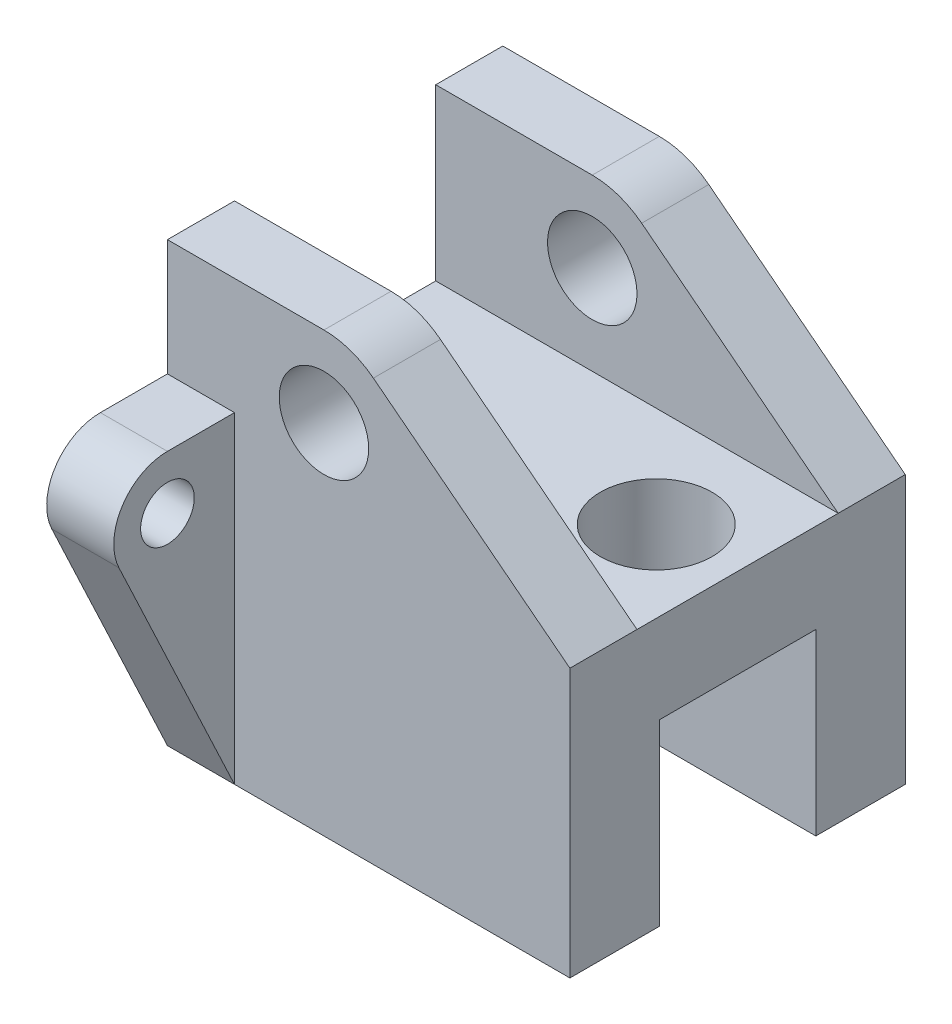
from build123d import *

# Parameters (mm, degrees)
BOSS_EXTRUDE1_DEPTH = 90
SKETCH2_R           = 10
BOSS_EXTRUDE2_DEPTH = 15
BOSS_EXTRUDE3_START = -15
SKETCH3_R           = 10
BOSS_EXTRUDE3_DEPTH = 15
SKETCH5_R           = 6
BOSS_EXTRUDE4_DEPTH = 15
SKETCH6_R           = 6
BOSS_EXTRUDE5_DEPTH = 15
SKETCH7_R           = 12.5
CUT_EXTRUDE1_DEPTH  = 133.315560912


with BuildPart() as part:
    # Sketch1 → Boss-Extrude1 (new body)
    with BuildSketch(Plane(origin=(0, 0, 0), x_dir=(0, 0, -1), z_dir=(1, 0, 0))):
        Polygon((-25.793650794, 0), (-25.793650794, 60), (49.206349206, 60), (49.206349206, 0), (29.206349206, 0), (29.206349206, 40), (-5.793650794, 40), (-5.793650794, 0), align=None)
    extrude(amount=-BOSS_EXTRUDE1_DEPTH)

    # Sketch2 → Boss-Extrude2 (add)
    with BuildSketch(Plane.XY.offset(25.793650794)):
        with BuildLine():
            Line((0, 60), (-43.943887784, 94.204308595))
            ThreePointArc((-43.943887784, 94.204308595), (-49.155239727, 97.024652048), (-55, 98))
            Line((-55, 98), (-90, 98))
            Line((-90, 98), (-90, 60))
            Line((-90, 60), (0, 60))
        make_face()
        with Locations((-55, 80)):
            Circle(SKETCH2_R, mode=Mode.SUBTRACT)
    extrude(amount=-BOSS_EXTRUDE2_DEPTH)

    # Sketch3 → Boss-Extrude3 (add)
    with BuildSketch(Plane(origin=(0, 0, -49.206349206), x_dir=(-1, 0, 0), z_dir=(0, 0, -1)).offset(BOSS_EXTRUDE3_START)):
        with BuildLine():
            Line((0, 60), (90, 60))
            Line((90, 60), (90, 98))
            Line((90, 98), (55, 98))
            ThreePointArc((55, 98), (49.155239727, 97.024652048), (43.943887784, 94.204308595))
            Line((43.943887784, 94.204308595), (0, 60))
        make_face()
        with Locations(Location((55, 80, 0), (0, 0, 180))):
            Circle(SKETCH3_R, mode=Mode.SUBTRACT)
    extrude(amount=BOSS_EXTRUDE3_DEPTH)

    # Sketch5 → Boss-Extrude4 (add)
    with BuildSketch(Plane.ZY.offset(90)):
        with BuildLine():
            Line((25.793650794, 0), (25.793650794, 72))
            Line((25.793650794, 72), (40.793650794, 72))
            ThreePointArc((40.793650794, 72), (50.926944716, 66.427779888), (51.649414605, 54.886059047))
            Line((51.649414605, 54.886059047), (25.793650794, 0))
        make_face()
        with Locations((40.793650794, 60)):
            Circle(SKETCH5_R, mode=Mode.SUBTRACT)
    extrude(amount=-BOSS_EXTRUDE4_DEPTH)

    # Sketch6 → Boss-Extrude5 (add)
    with BuildSketch(Plane.ZY.offset(90)):
        with BuildLine():
            Line((-49.206349206, 0), (-75.062113018, 54.886059047))
            ThreePointArc((-75.062113018, 54.886059047), (-74.339643129, 66.427779888), (-64.206349206, 72))
            Line((-64.206349206, 72), (-49.206349206, 72))
            Line((-49.206349206, 72), (-49.206349206, 0))
        make_face()
        with Locations((-64.206349206, 60)):
            Circle(SKETCH6_R, mode=Mode.SUBTRACT)
    extrude(amount=-BOSS_EXTRUDE5_DEPTH)

    # Sketch7 → Cut-Extrude1 (cut, through all)
    with BuildSketch(Plane(origin=(0, 60, 0), x_dir=(1, 0, 0), z_dir=(0, 1, 0))):
        with Locations(Location((-18.195009626, 11.706349206, 0), (0, 0, 270))):
            Circle(SKETCH7_R)
    extrude(amount=-CUT_EXTRUDE1_DEPTH, mode=Mode.SUBTRACT)


solid = part.part
